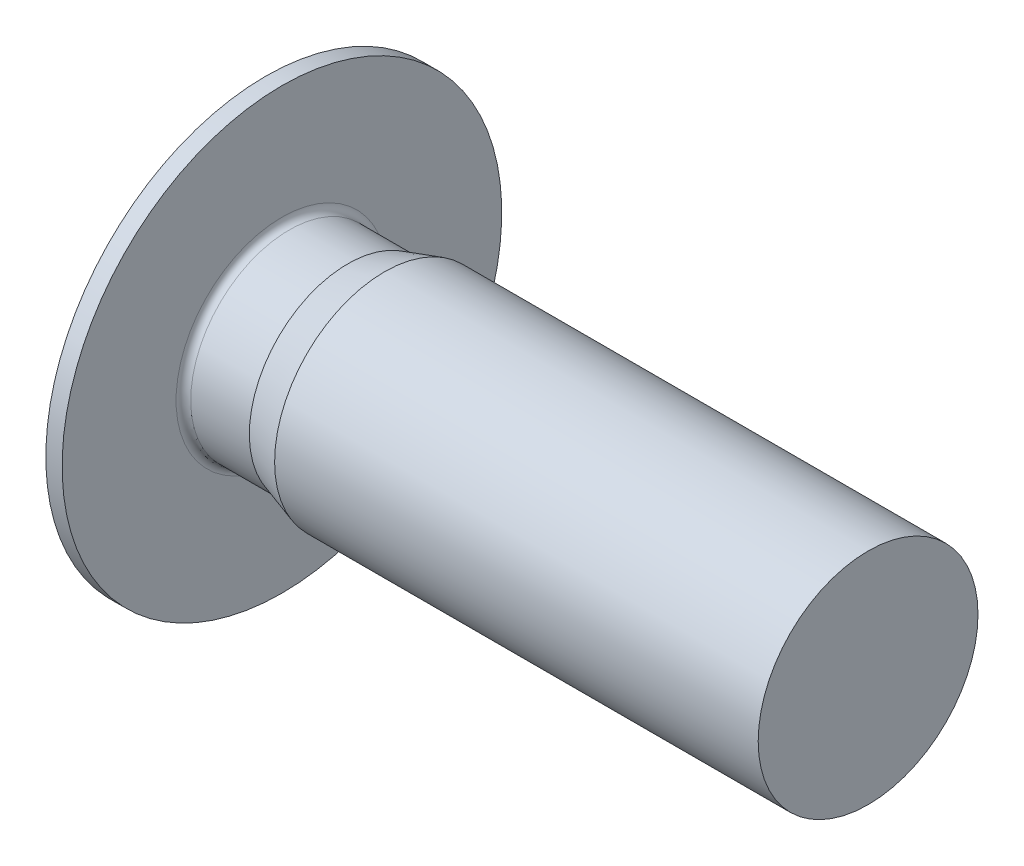
from build123d import *

# Parameters (mm, degrees)
FILLET1_R          = 0.1
CUT_EXTRUDE1_DEPTH = 2


with BuildPart() as part:
    # Sketch1 → Revolve1 (revolve)
    with BuildSketch(Plane.XY, mode=Mode.PRIVATE) as revolve1_sk:
        Polygon((-0.8, 0), (-0.8, 2), (-0.222649731, 3), (0, 3), (0, 1.345), (0.9, 1.345), (1.4, 1.5), (8, 1.5), (8, 0), align=None)
    revolve(revolve1_sk.sketch.rotate(Axis((-0.8, 0, 0), (1, 0, 0)), 180), axis=Axis((-0.8, 0, 0), (1, 0, 0)))

    # Fillet1
    fillet1_edges = [part.edges().sort_by_distance(p)[0] for p in [
        (0, 1.345, 0),
    ]]
    fillet(fillet1_edges, radius=FILLET1_R)

    # Sketch2 → Cut-Extrude1 (cut)
    with BuildSketch(Plane.ZY.offset(0.8)):
        Polygon((0, 0.866025404), (-0.75, 0.433012702), (-0.75, -0.433012702), (0, -0.866025404), (0.75, -0.433012702), (0.75, 0.433012702), align=None)
    extrude(amount=-CUT_EXTRUDE1_DEPTH, mode=Mode.SUBTRACT)

    # Sketch3 → Cut-Revolve1 (revolve, cut)
    with BuildSketch(Plane.XY, mode=Mode.PRIVATE) as cut_revolve1_sk:
        Polygon((1.2, 0), (1.2, 0.75), (1.650645464, 0), align=None)
    revolve(cut_revolve1_sk.sketch.rotate(Axis((1.2, 0, 0), (1, 0, 0)), 180), axis=Axis((1.2, 0, 0), (1, 0, 0)), mode=Mode.SUBTRACT)


solid = part.part
